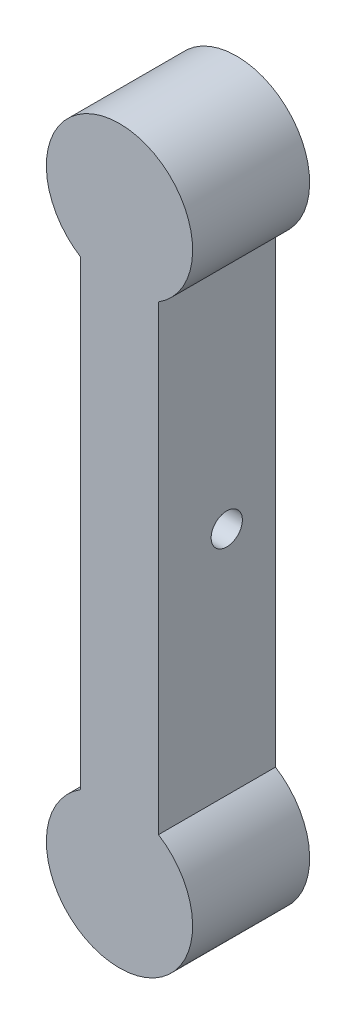
from build123d import *

# Parameters (mm, degrees)
ESBO_O1_R                = 4
RESSALTO_EXTRUS_O1_DEPTH = 10
ESBO_O2_R                = 1.6
CORTE_EXTRUS_O1_DEPTH    = 10
RESSALTO_EXTRUS_O2_DEPTH = 2


with BuildPart() as part:
    # Esboço1 → Ressalto-extrusão1 (new body)
    with BuildSketch(Plane.XY):
        with BuildLine():
            Line((4, 53.65571123), (4, 6.34428877))
            ThreePointArc((4, 6.34428877), (0, -7.5), (-4, 6.34428877))
            Line((-4, 6.34428877), (-4, 53.65571123))
            ThreePointArc((-4, 53.65571123), (0, 67.5), (4, 53.65571123))
        make_face()
        with Locations((0, 60)):
            Circle(ESBO_O1_R, mode=Mode.SUBTRACT)
        Circle(ESBO_O1_R, mode=Mode.SUBTRACT)
    extrude(amount=RESSALTO_EXTRUS_O1_DEPTH)

    # Esboço2 → Corte-extrusão1 (cut)
    with BuildSketch(Plane.ZY.offset(4)):
        with Locations(Location((5, 30, 0), (0, 0, 270))):
            Circle(ESBO_O2_R)
    extrude(amount=-CORTE_EXTRUS_O1_DEPTH, mode=Mode.SUBTRACT)

    # Esboço3 → Ressalto-extrusão2 (add)
    with BuildSketch(Plane.XY.offset(10)):
        with BuildLine():
            Line((-4, 53.65571123), (-4, 6.34428877))
            ThreePointArc((-4, 6.34428877), (0, -7.5), (4, 6.34428877))
            Line((4, 6.34428877), (4, 53.65571123))
            ThreePointArc((4, 53.65571123), (0, 67.5), (-4, 53.65571123))
        make_face()
    extrude(amount=RESSALTO_EXTRUS_O2_DEPTH)


solid = part.part
